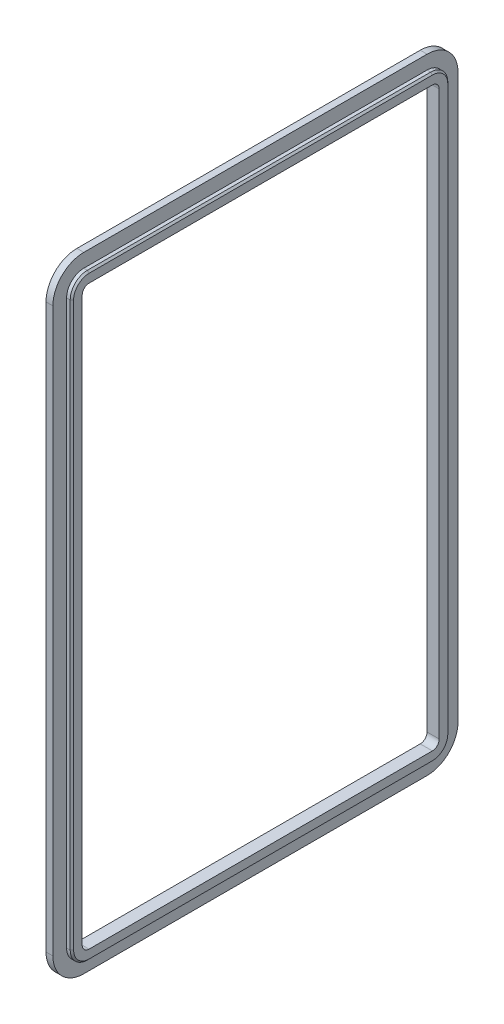
from build123d import *

# Parameters (mm, degrees)
BOSS_EXTRUDE1_DEPTH     = 0.77
BOSS_EXTRUDE2_DEPTH     = 1
CUT_EXTRUDE1_DEPTH      = 55.235597166
CUT_EXTRUDE1_DEPTH_BACK = 55.235597166
CHAMFER1_SIZE           = 0.25


with BuildPart() as part:
    # Sketch2 → Boss-Extrude1 (new body)
    with BuildSketch(Plane.ZY):
        with BuildLine():
            Line((-27.5, 41), (-27.5, -41))
            ThreePointArc((-27.5, -41), (-26.767766953, -42.767766953), (-25, -43.5))
            Line((-25, -43.5), (25, -43.5))
            ThreePointArc((25, -43.5), (26.767766953, -42.767766953), (27.5, -41))
            Line((27.5, -41), (27.5, 41))
            ThreePointArc((27.5, 41), (26.767766953, 42.767766953), (25, 43.5))
            Line((25, 43.5), (-25, 43.5))
            ThreePointArc((-25, 43.5), (-26.767766953, 42.767766953), (-27.5, 41))
        make_face()
    extrude(amount=-BOSS_EXTRUDE1_DEPTH)

    # Sketch3 → Boss-Extrude2 (add)
    with BuildSketch(Plane.ZY):
        with BuildLine():
            Line((-29.5, 41), (-29.5, -41))
            ThreePointArc((-29.5, -41), (-28.181980515, -44.181980515), (-25, -45.5))
            Line((-25, -45.5), (25, -45.5))
            ThreePointArc((25, -45.5), (28.181980515, -44.181980515), (29.5, -41))
            Line((29.5, -41), (29.5, 41))
            ThreePointArc((29.5, 41), (28.181980515, 44.181980515), (25, 45.5))
            Line((25, 45.5), (-25, 45.5))
            ThreePointArc((-25, 45.5), (-28.181980515, 44.181980515), (-29.5, 41))
        make_face()
    extrude(amount=BOSS_EXTRUDE2_DEPTH)

    # Sketch3<3> → Cut-Extrude1 (cut, two sides: drawn at the far end of the back side and taken through both)
    with BuildSketch(Plane.ZY.offset(-CUT_EXTRUDE1_DEPTH_BACK)):
        with BuildLine():
            Line((25, 41.999999952), (-25, 41.999999952))
            ThreePointArc((-25, 41.999999952), (-25.707106747, 41.707106747), (-25.999999952, 41))
            Line((-25.999999952, 41), (-25.999999952, -41))
            ThreePointArc((-25.999999952, -41), (-25.707106747, -41.707106747), (-25, -41.999999952))
            Line((-25, -41.999999952), (25, -41.999999952))
            ThreePointArc((25, -41.999999952), (25.707106747, -41.707106747), (25.999999952, -41))
            Line((25.999999952, -41), (25.999999952, 41))
            ThreePointArc((25.999999952, 41), (25.707106747, 41.707106747), (25, 41.999999952))
        make_face()
    extrude(amount=CUT_EXTRUDE1_DEPTH + CUT_EXTRUDE1_DEPTH_BACK, mode=Mode.SUBTRACT)

    # Chamfer1
    chamfer1_edges = [part.edges().sort_by_distance(p)[0] for p in [
        (0.77, -43.5, 0),
        (0.77, -42.767766953, 26.767766953),
        (0.77, 0, 27.5),
        (0.77, 42.767766953, 26.767766953),
        (0.77, 43.5, 0),
        (0.77, 42.767766953, -26.767766953),
        (0.77, 0, -27.5),
        (0.77, -42.767766953, -26.767766953),
    ]]
    chamfer(chamfer1_edges, length=CHAMFER1_SIZE)


solid = part.part
